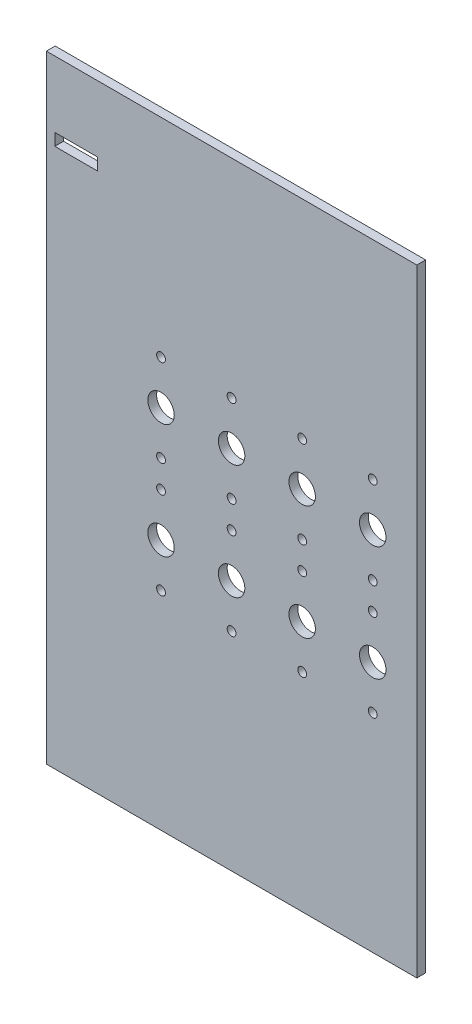
from build123d import *

# Parameters (mm, degrees)
SKETCH_1_W          = 420
SKETCH_1_H          = 700
SKETCH_1_R          = 5
SKETCH_1_R_2        = 15
EXTRUDE_1_DEPTH     = 10
SKETCH_2_W          = 48.23
SKETCH_2_H          = 13.71
CUT_EXTRUDE_1_DEPTH = 10


with BuildPart() as part:
    # 草图1 → 凸台-拉伸1 (new body)
    with BuildSketch(Plane.XY):
        with Locations((210, 0)):
            Rectangle(SKETCH_1_W, SKETCH_1_H)
        with Locations((130, 114.5)):
            Circle(SKETCH_1_R, mode=Mode.SUBTRACT)
        with Locations((130, 15.5)):
            Circle(SKETCH_1_R, mode=Mode.SUBTRACT)
        with Locations((210, 114.5)):
            Circle(SKETCH_1_R, mode=Mode.SUBTRACT)
        with Locations((210, 15.5)):
            Circle(SKETCH_1_R, mode=Mode.SUBTRACT)
        with Locations((290, 114.5)):
            Circle(SKETCH_1_R, mode=Mode.SUBTRACT)
        with Locations((290, 15.5)):
            Circle(SKETCH_1_R, mode=Mode.SUBTRACT)
        with Locations((370, 114.5)):
            Circle(SKETCH_1_R, mode=Mode.SUBTRACT)
        with Locations((370, 15.5)):
            Circle(SKETCH_1_R, mode=Mode.SUBTRACT)
        with Locations((130, 65)):
            Circle(SKETCH_1_R_2, mode=Mode.SUBTRACT)
        with Locations((210, 65)):
            Circle(SKETCH_1_R_2, mode=Mode.SUBTRACT)
        with Locations((290, 65)):
            Circle(SKETCH_1_R_2, mode=Mode.SUBTRACT)
        with Locations((370, 65)):
            Circle(SKETCH_1_R_2, mode=Mode.SUBTRACT)
        with Locations((130, -114.5)):
            Circle(SKETCH_1_R, mode=Mode.SUBTRACT)
        with Locations((130, -15.5)):
            Circle(SKETCH_1_R, mode=Mode.SUBTRACT)
        with Locations((210, -114.5)):
            Circle(SKETCH_1_R, mode=Mode.SUBTRACT)
        with Locations((210, -15.5)):
            Circle(SKETCH_1_R, mode=Mode.SUBTRACT)
        with Locations((290, -114.5)):
            Circle(SKETCH_1_R, mode=Mode.SUBTRACT)
        with Locations((290, -15.5)):
            Circle(SKETCH_1_R, mode=Mode.SUBTRACT)
        with Locations((370, -114.5)):
            Circle(SKETCH_1_R, mode=Mode.SUBTRACT)
        with Locations((370, -15.5)):
            Circle(SKETCH_1_R, mode=Mode.SUBTRACT)
        with Locations((130, -65)):
            Circle(SKETCH_1_R_2, mode=Mode.SUBTRACT)
        with Locations((210, -65)):
            Circle(SKETCH_1_R_2, mode=Mode.SUBTRACT)
        with Locations((290, -65)):
            Circle(SKETCH_1_R_2, mode=Mode.SUBTRACT)
        with Locations((370, -65)):
            Circle(SKETCH_1_R_2, mode=Mode.SUBTRACT)
    extrude(amount=EXTRUDE_1_DEPTH)

    # 草图2 → 切除-拉伸1 (cut)
    with BuildSketch(Plane(origin=(0, 0, 0), x_dir=(-1, 0, 0), z_dir=(0, 0, -1))):
        with Locations((-33.645, 268.145)):
            Rectangle(SKETCH_2_W, SKETCH_2_H)
    extrude(amount=-CUT_EXTRUDE_1_DEPTH, mode=Mode.SUBTRACT)


solid = part.part
